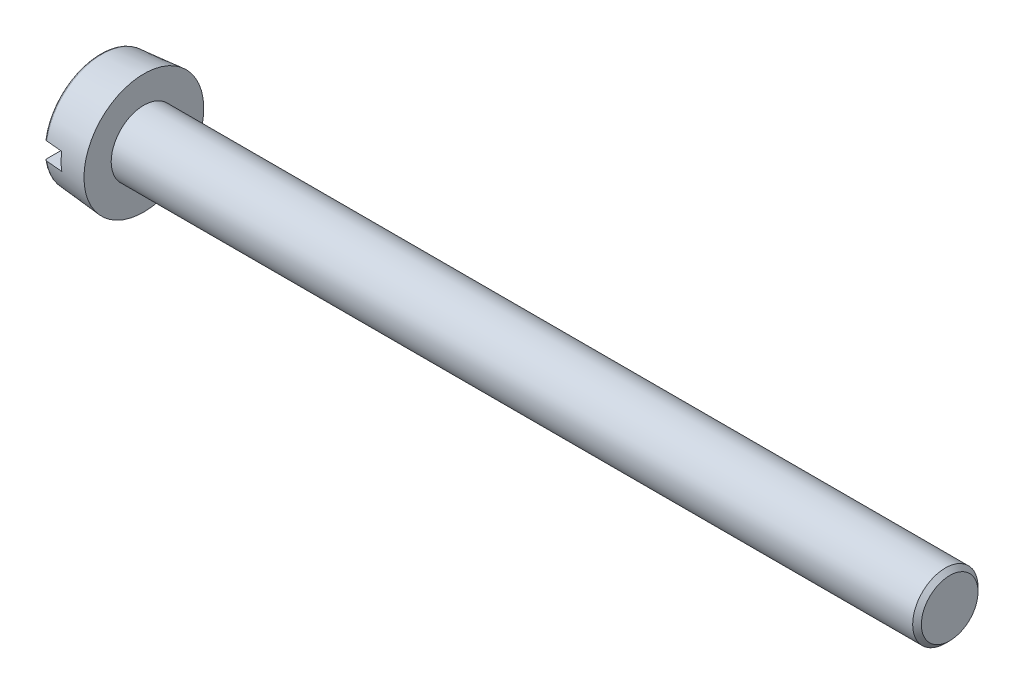
from build123d import *

# Parameters (mm, degrees)
FILLET2_R     = 0.1
SKETCH2_W     = 5.5
SKETCH2_H     = 0.8
SLOT_DEPTH    = 0.85
CHAMFER1_SIZE = 0.2


with BuildPart() as part:
    # BodySke → Base-Revolve (revolve)
    with BuildSketch(Plane.XY):
        Polygon((2, 1.5), (2, 2.75), (0, 2.575022673), (0, 0), (39, 0), (39, 1.5), align=None)
    revolve(axis=Axis((-25.4, 0, 0), (1, 0, 0)))

    # Fillet2
    fillet2_edges = [part.edges().sort_by_distance(p)[0] for p in [
        (0, -2.575022673, 0),
    ]]
    fillet(fillet2_edges, radius=FILLET2_R)

    # Sketch2 → Slot (cut)
    with BuildSketch(Plane(origin=(0, 0, 0), x_dir=(0, 0, -1), z_dir=(1, 0, 0))):
        Rectangle(SKETCH2_W, SKETCH2_H)
    extrude(amount=SLOT_DEPTH, mode=Mode.SUBTRACT)

    # Chamfer1
    chamfer1_edges = [part.edges().sort_by_distance(p)[0] for p in [
        (39, -1.5, 0),
    ]]
    chamfer(chamfer1_edges, length=CHAMFER1_SIZE)


solid = part.part
